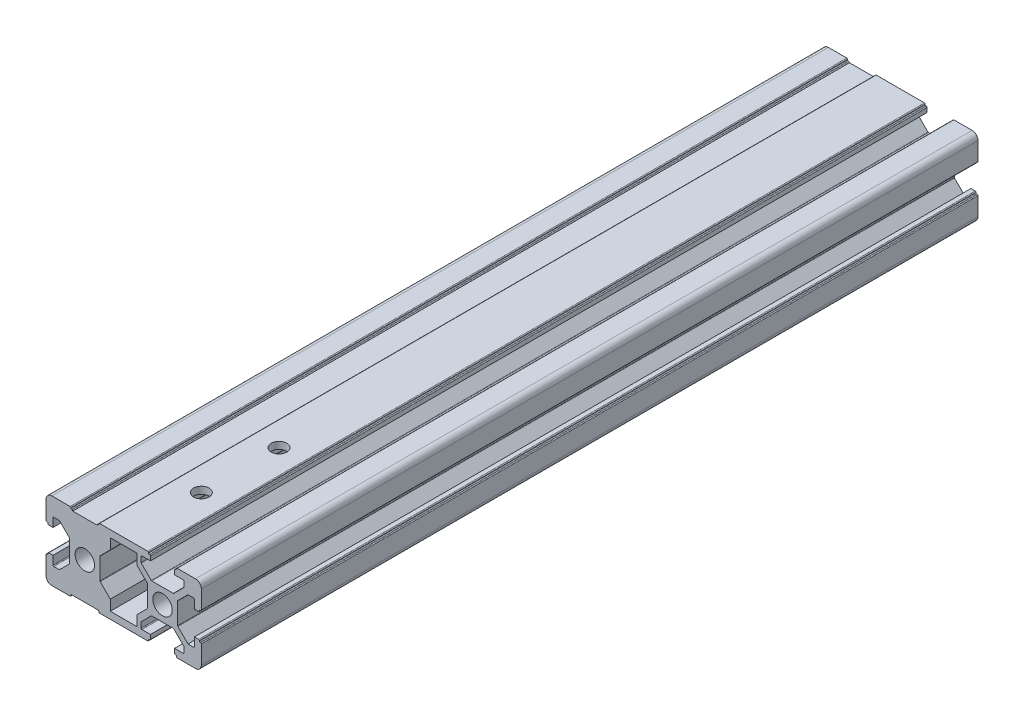
from build123d import *

# Parameters (mm, degrees)
BOSS_EXTRUDE1_DEPTH = 200
SKETCH2_R           = 2.5
CUT_EXTRUDE1_DEPTH  = 203.484567313
SKETCH3_R           = 2
CUT_EXTRUDE2_DEPTH  = 40


with BuildPart() as part:
    # Sketch1 → Boss-Extrude1 (new body)
    with BuildSketch(Plane.XY):
        with BuildLine():
            Line((-8.5, 10), (-3.8, 10))
            ThreePointArc((-3.8, 10), (-3.658578644, 9.941421356), (-3.6, 9.8))
            Line((-3.6, 9.8), (-3.6, 9.7))
            ThreePointArc((-3.6, 9.7), (-3.541421356, 9.558578644), (-3.4, 9.5))
            Line((-3.4, 9.5), (-3.3, 9.5))
            ThreePointArc((-3.3, 9.5), (-3.158578644, 9.441421356), (-3.1, 9.3))
            Line((-3.1, 9.3), (3.1, 9.3))
            ThreePointArc((3.1, 9.3), (3.158578644, 9.441421356), (3.3, 9.5))
            Line((3.3, 9.5), (3.4, 9.5))
            ThreePointArc((3.4, 9.5), (3.541421356, 9.558578644), (3.6, 9.7))
            Line((3.6, 9.7), (3.6, 9.8))
            ThreePointArc((3.6, 9.8), (3.658578644, 9.941421356), (3.8, 10))
            Line((3.8, 10), (8.5, 10))
            Line((8.5, 10), (11.5, 10))
            Line((11.5, 10), (16.2, 10))
            ThreePointArc((16.2, 10), (16.341421356, 9.941421356), (16.4, 9.8))
            Line((16.4, 9.8), (16.4, 9.7))
            ThreePointArc((16.4, 9.7), (16.458578644, 9.558578644), (16.6, 9.5))
            Line((16.6, 9.5), (16.7, 9.5))
            ThreePointArc((16.7, 9.5), (16.841421356, 9.441421356), (16.9, 9.3))
            Line((16.9, 9.3), (16.9, 8.2))
            Line((16.9, 8.2), (14.7, 8.2))
            ThreePointArc((14.7, 8.2), (14.558578644, 8.141421356), (14.5, 8))
            Line((14.5, 8), (14.5, 6.560660172))
            Line((14.5, 6.560660172), (17.102081528, 3.958578644))
            ThreePointArc((17.102081528, 3.958578644), (17.166966198, 3.915224093), (17.243502884, 3.9))
            Line((17.243502884, 3.9), (22.756497116, 3.9))
            ThreePointArc((22.756497116, 3.9), (22.833033802, 3.915224093), (22.897918472, 3.958578644))
            Line((22.897918472, 3.958578644), (25.5, 6.560660172))
            Line((25.5, 6.560660172), (25.5, 8))
            ThreePointArc((25.5, 8), (25.441421356, 8.141421356), (25.3, 8.2))
            Line((25.3, 8.2), (23.1, 8.2))
            Line((23.1, 8.2), (23.1, 9.3))
            ThreePointArc((23.1, 9.3), (23.158578644, 9.441421356), (23.3, 9.5))
            Line((23.3, 9.5), (23.4, 9.5))
            ThreePointArc((23.4, 9.5), (23.541421356, 9.558578644), (23.6, 9.7))
            Line((23.6, 9.7), (23.6, 9.8))
            ThreePointArc((23.6, 9.8), (23.658578644, 9.941421356), (23.8, 10))
            Line((23.8, 10), (28.5, 10))
            ThreePointArc((28.5, 10), (29.560660172, 9.560660172), (30, 8.5))
            Line((30, 8.5), (30, 3.8))
            ThreePointArc((30, 3.8), (29.941421356, 3.658578644), (29.8, 3.6))
            Line((29.8, 3.6), (29.7, 3.6))
            ThreePointArc((29.7, 3.6), (29.558578644, 3.541421356), (29.5, 3.4))
            Line((29.5, 3.4), (29.5, 3.3))
            ThreePointArc((29.5, 3.3), (29.441421356, 3.158578644), (29.3, 3.1))
            Line((29.3, 3.1), (28.2, 3.1))
            Line((28.2, 3.1), (28.2, 5.3))
            ThreePointArc((28.2, 5.3), (28.141421356, 5.441421356), (28, 5.5))
            Line((28, 5.5), (26.560660172, 5.5))
            Line((26.560660172, 5.5), (23.958578644, 2.897918472))
            ThreePointArc((23.958578644, 2.897918472), (23.915224093, 2.833033802), (23.9, 2.756497116))
            Line((23.9, 2.756497116), (23.9, -2.756497116))
            ThreePointArc((23.9, -2.756497116), (23.915224093, -2.833033802), (23.958578644, -2.897918472))
            Line((23.958578644, -2.897918472), (26.560660172, -5.5))
            Line((26.560660172, -5.5), (28, -5.5))
            ThreePointArc((28, -5.5), (28.141421356, -5.441421356), (28.2, -5.3))
            Line((28.2, -5.3), (28.2, -3.1))
            Line((28.2, -3.1), (29.3, -3.1))
            ThreePointArc((29.3, -3.1), (29.441421356, -3.158578644), (29.5, -3.3))
            Line((29.5, -3.3), (29.5, -3.4))
            ThreePointArc((29.5, -3.4), (29.558578644, -3.541421356), (29.7, -3.6))
            Line((29.7, -3.6), (29.8, -3.6))
            ThreePointArc((29.8, -3.6), (29.941421356, -3.658578644), (30, -3.8))
            Line((30, -3.8), (30, -8.5))
            ThreePointArc((30, -8.5), (29.560660172, -9.560660172), (28.5, -10))
            Line((28.5, -10), (23.8, -10))
            ThreePointArc((23.8, -10), (23.658578644, -9.941421356), (23.6, -9.8))
            Line((23.6, -9.8), (23.6, -9.7))
            ThreePointArc((23.6, -9.7), (23.541421356, -9.558578644), (23.4, -9.5))
            Line((23.4, -9.5), (23.3, -9.5))
            ThreePointArc((23.3, -9.5), (23.158578644, -9.441421356), (23.1, -9.3))
            Line((23.1, -9.3), (23.1, -8.2))
            Line((23.1, -8.2), (25.3, -8.2))
            ThreePointArc((25.3, -8.2), (25.441421356, -8.141421356), (25.5, -8))
            Line((25.5, -8), (25.5, -6.560660172))
            Line((25.5, -6.560660172), (22.897918472, -3.958578644))
            ThreePointArc((22.897918472, -3.958578644), (22.833033802, -3.915224093), (22.756497116, -3.9))
            Line((22.756497116, -3.9), (17.243502884, -3.9))
            ThreePointArc((17.243502884, -3.9), (17.166966198, -3.915224093), (17.102081528, -3.958578644))
            Line((17.102081528, -3.958578644), (14.5, -6.560660172))
            Line((14.5, -6.560660172), (14.5, -8))
            ThreePointArc((14.5, -8), (14.558578644, -8.141421356), (14.7, -8.2))
            Line((14.7, -8.2), (16.9, -8.2))
            Line((16.9, -8.2), (16.9, -9.3))
            ThreePointArc((16.9, -9.3), (16.841421356, -9.441421356), (16.7, -9.5))
            Line((16.7, -9.5), (16.6, -9.5))
            ThreePointArc((16.6, -9.5), (16.458578644, -9.558578644), (16.4, -9.7))
            Line((16.4, -9.7), (16.4, -9.8))
            ThreePointArc((16.4, -9.8), (16.341421356, -9.941421356), (16.2, -10))
            Line((16.2, -10), (11.5, -10))
            Line((11.5, -10), (8.5, -10))
            Line((8.5, -10), (3.8, -10))
            ThreePointArc((3.8, -10), (3.658578644, -9.941421356), (3.6, -9.8))
            Line((3.6, -9.8), (3.6, -9.7))
            ThreePointArc((3.6, -9.7), (3.541421356, -9.558578644), (3.4, -9.5))
            Line((3.4, -9.5), (3.3, -9.5))
            Line((3.3, -9.5), (-3.3, -9.5))
            Line((-3.3, -9.5), (-3.4, -9.5))
            ThreePointArc((-3.4, -9.5), (-3.541421356, -9.558578644), (-3.6, -9.7))
            Line((-3.6, -9.7), (-3.6, -9.8))
            ThreePointArc((-3.6, -9.8), (-3.658578644, -9.941421356), (-3.8, -10))
            Line((-3.8, -10), (-8.5, -10))
            ThreePointArc((-8.5, -10), (-9.560660172, -9.560660172), (-10, -8.5))
            Line((-10, -8.5), (-10, -3.8))
            ThreePointArc((-10, -3.8), (-9.941421356, -3.658578644), (-9.8, -3.6))
            Line((-9.8, -3.6), (-9.7, -3.6))
            ThreePointArc((-9.7, -3.6), (-9.558578644, -3.541421356), (-9.5, -3.4))
            Line((-9.5, -3.4), (-9.5, -3.3))
            ThreePointArc((-9.5, -3.3), (-9.441421356, -3.158578644), (-9.3, -3.1))
            Line((-9.3, -3.1), (-8.2, -3.1))
            Line((-8.2, -3.1), (-8.2, -5.3))
            ThreePointArc((-8.2, -5.3), (-8.141421356, -5.441421356), (-8, -5.5))
            Line((-8, -5.5), (-6.560660172, -5.5))
            Line((-6.560660172, -5.5), (-3.958578644, -2.897918472))
            ThreePointArc((-3.958578644, -2.897918472), (-3.915224093, -2.833033802), (-3.9, -2.756497116))
            Line((-3.9, -2.756497116), (-3.9, 2.756497116))
            ThreePointArc((-3.9, 2.756497116), (-3.915224093, 2.833033802), (-3.958578644, 2.897918472))
            Line((-3.958578644, 2.897918472), (-6.560660172, 5.5))
            Line((-6.560660172, 5.5), (-8, 5.5))
            ThreePointArc((-8, 5.5), (-8.141421356, 5.441421356), (-8.2, 5.3))
            Line((-8.2, 5.3), (-8.2, 3.1))
            Line((-8.2, 3.1), (-9.3, 3.1))
            ThreePointArc((-9.3, 3.1), (-9.441421356, 3.158578644), (-9.5, 3.3))
            Line((-9.5, 3.3), (-9.5, 3.4))
            ThreePointArc((-9.5, 3.4), (-9.558578644, 3.541421356), (-9.7, 3.6))
            Line((-9.7, 3.6), (-9.8, 3.6))
            ThreePointArc((-9.8, 3.6), (-9.941421356, 3.658578644), (-10, 3.8))
            Line((-10, 3.8), (-10, 8.5))
            ThreePointArc((-10, 8.5), (-9.560660172, 9.560660172), (-8.5, 10))
        make_face()
        with BuildLine():
            Line((3.9, 2.756497116), (3.9, -2.756497116))
            ThreePointArc((3.9, -2.756497116), (3.915224093, -2.833033802), (3.958578644, -2.897918472))
            Line((3.958578644, -2.897918472), (6.560660172, -5.5))
            Line((6.560660172, -5.5), (6.560660172, -8.2))
            Line((6.560660172, -8.2), (13.439339828, -8.2))
            Line((13.439339828, -8.2), (13.439339828, -5.5))
            Line((13.439339828, -5.5), (16.041421356, -2.897918472))
            ThreePointArc((16.041421356, -2.897918472), (16.084775907, -2.833033802), (16.1, -2.756497116))
            Line((16.1, -2.756497116), (16.1, 2.756497116))
            ThreePointArc((16.1, 2.756497116), (16.084775907, 2.833033802), (16.041421356, 2.897918472))
            Line((16.041421356, 2.897918472), (13.439339828, 5.5))
            Line((13.439339828, 5.5), (13.439339828, 8.2))
            Line((13.439339828, 8.2), (6.560660172, 8.2))
            Line((6.560660172, 8.2), (6.560660172, 5.5))
            Line((6.560660172, 5.5), (3.958578644, 2.897918472))
            ThreePointArc((3.958578644, 2.897918472), (3.915224093, 2.833033802), (3.9, 2.756497116))
        make_face(mode=Mode.SUBTRACT)
    extrude(amount=BOSS_EXTRUDE1_DEPTH)

    # Sketch2 → Cut-Extrude1 (cut, through all)
    with BuildSketch(Plane.XY.offset(200)):
        Circle(SKETCH2_R)
        with Locations(Location((20, 0, 0), (0, 0, 180))):
            Circle(SKETCH2_R)
    extrude(amount=-CUT_EXTRUDE1_DEPTH, mode=Mode.SUBTRACT)

    # Sketch3 → Cut-Extrude2 (cut)
    with BuildSketch(Plane(origin=(0, -10, 0), x_dir=(-1, 0, 0), z_dir=(0, -1, 0))):
        with Locations(Location((-10, -180, 0), (0, 0, 180))):
            Circle(SKETCH3_R)
        with Locations(Location((-10, -160, 0), (0, 0, 180))):
            Circle(SKETCH3_R)
    extrude(amount=-CUT_EXTRUDE2_DEPTH, mode=Mode.SUBTRACT)


solid = part.part
